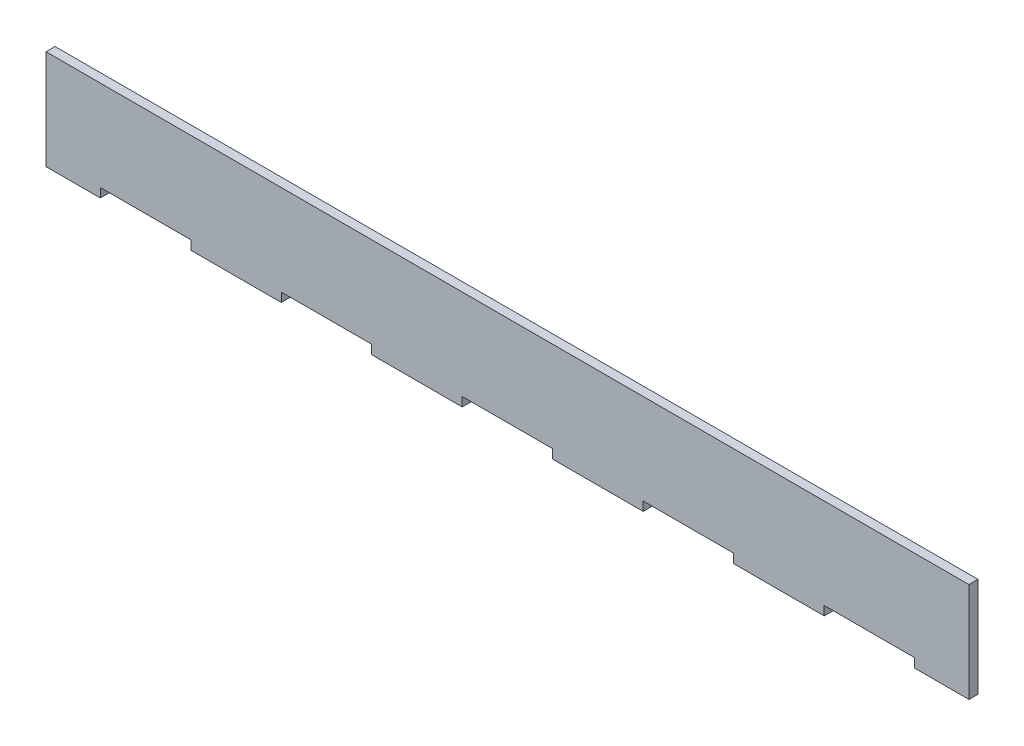
from build123d import *

# Parameters (mm, degrees)
SKETCH_1_W          = 510
SKETCH_1_H          = 55
EXTRUDE_1_DEPTH     = 5
SKETCH_2_W          = 50
SKETCH_2_H          = 5
CUT_EXTRUDE_1_DEPTH = 5


with BuildPart() as part:
    # ｽｹｯﾁ1 → ﾎﾞｽ - 押し出し1 (new body)
    with BuildSketch(Plane.XY):
        Rectangle(SKETCH_1_W, SKETCH_1_H)
    extrude(amount=EXTRUDE_1_DEPTH)

    # ｽｹｯﾁ2 → ｶｯﾄ - 押し出し1 (cut)
    with BuildSketch(Plane.XY.offset(5)):
        with Locations((0, -25)):
            Rectangle(SKETCH_2_W, SKETCH_2_H)
        with Locations((-100, -25)):
            Rectangle(SKETCH_2_W, SKETCH_2_H)
        with Locations((100, -25)):
            Rectangle(SKETCH_2_W, SKETCH_2_H)
        with Locations((200, -25)):
            Rectangle(SKETCH_2_W, SKETCH_2_H)
        with Locations((-200, -25)):
            Rectangle(SKETCH_2_W, SKETCH_2_H)
    extrude(amount=-CUT_EXTRUDE_1_DEPTH, mode=Mode.SUBTRACT)


solid = part.part
